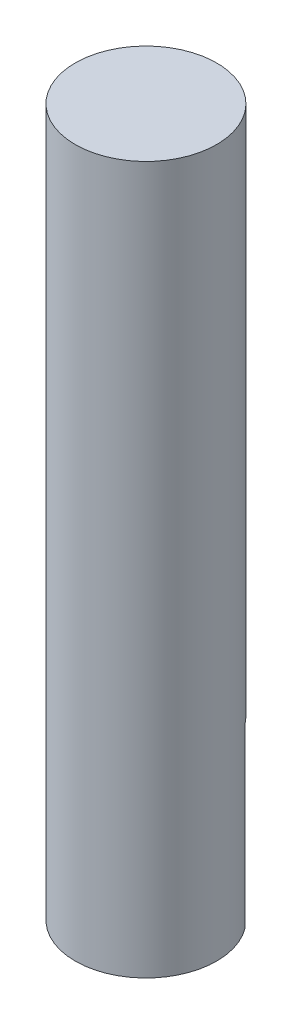
from build123d import *

# Parameters (mm, degrees)
SKETCH2_R           = 5
BOSS_EXTRUDE1_DEPTH = 50
CUT_EXTRUDE1_DEPTH  = 12.5


with BuildPart() as part:
    # Sketch2 → Boss-Extrude1 (new body)
    with BuildSketch(Plane(origin=(0, 0, 0), x_dir=(1, 0, 0), z_dir=(0, 1, 0))):
        with Locations(Location((0, 0, 0), (0, 0, 270))):
            Circle(SKETCH2_R)
    extrude(amount=BOSS_EXTRUDE1_DEPTH)

    # Sketch3 → Cut-Extrude1 (cut)
    with BuildSketch(Plane(origin=(0, 0, 0), x_dir=(1, 0, 0), z_dir=(0, 1, 0))):
        with BuildLine():
            Line((-4, 3), (4, 3))
            ThreePointArc((4, 3), (0, 5), (-4, 3))
        make_face()
    extrude(amount=CUT_EXTRUDE1_DEPTH, mode=Mode.SUBTRACT)


solid = part.part
